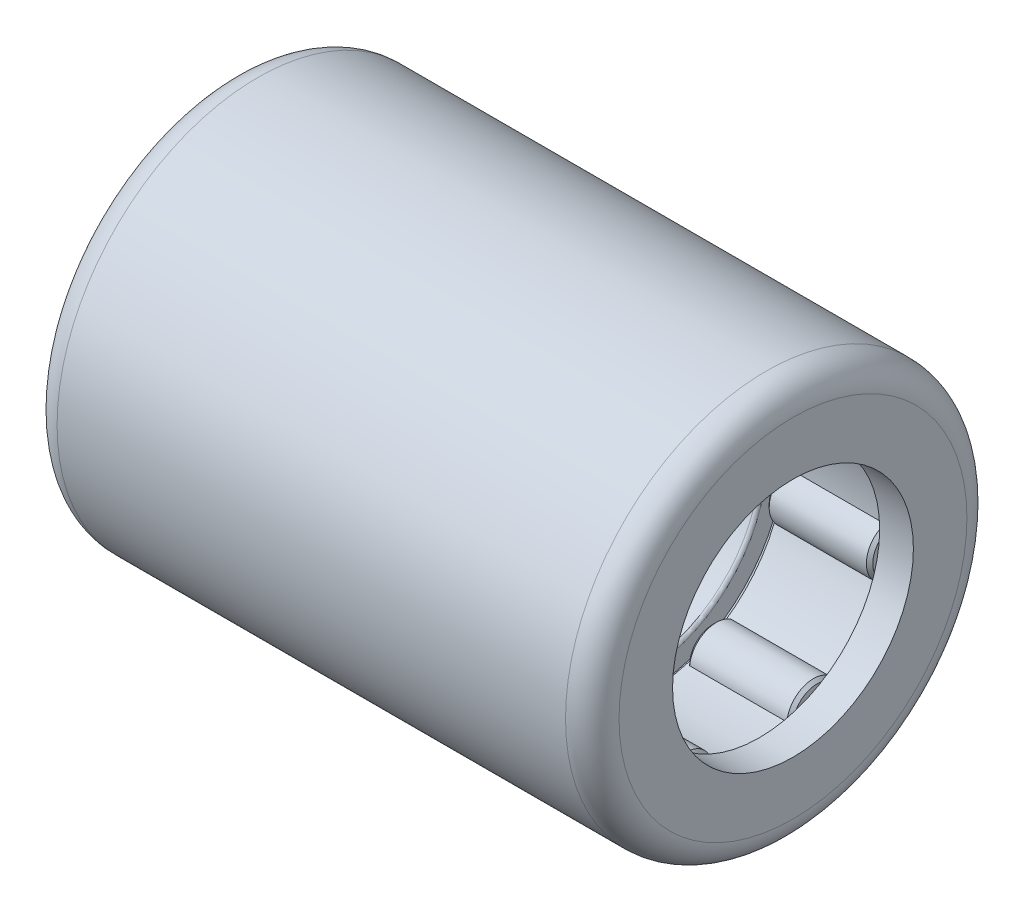
from build123d import *

# Parameters (mm, degrees)
CIRPATTERN1_COUNT = 7
CIRPATTERN2_COUNT = 11


with BuildPart() as part:
    # Sketch1 → Revolve1 (revolve)
    with BuildSketch(Plane.XY, mode=Mode.PRIVATE) as revolve1_sk:
        with BuildLine():
            Line((-11.1125, 6.879166667), (-11.1125, 4.7625))
            Line((-11.1125, 4.7625), (-9.779, 4.7625))
            Line((-9.779, 4.7625), (-9.779, 6.879166667))
            Line((-9.779, 6.879166667), (-5.174384091, 6.879166667))
            Line((-5.174384091, 6.879166667), (-4.040909091, 7.3025))
            Line((-4.040909091, 7.3025), (4.040909091, 7.3025))
            Line((4.040909091, 7.3025), (5.174384091, 6.879166667))
            Line((5.174384091, 6.879166667), (9.779, 6.879166667))
            Line((9.779, 6.879166667), (9.779, 4.7625))
            Line((9.779, 4.7625), (11.1125, 4.7625))
            Line((11.1125, 4.7625), (11.1125, 6.879166667))
            ThreePointArc((11.1125, 6.879166667), (10.802521343, 7.627521343), (10.054166667, 7.9375))
            Line((10.054166667, 7.9375), (-10.054166667, 7.9375))
            ThreePointArc((-10.054166667, 7.9375), (-10.802521343, 7.627521343), (-11.1125, 6.879166667))
        make_face()
    revolve(revolve1_sk.sketch.rotate(Axis((-11.1125, 0, 0), (1, 0, 0)), 90), axis=Axis((-11.1125, 0, 0), (1, 0, 0)))


with BuildPart() as body_2:
    # Sketch2 → Revolve2 (revolve)
    with BuildSketch(Plane.XY, mode=Mode.PRIVATE) as revolve2_sk:
        Polygon((-9.525, 5.820833333), (-5.428384091, 5.820833333), (-5.428384091, 4.8895), (-5.555384091, 4.7625), (-9.398, 4.7625), (-9.525, 4.8895), align=None)
    revolve(revolve2_sk.sketch.rotate(Axis((-9.779, 5.820833333, 0), (1, 0, 0)), 270), axis=Axis((-9.779, 5.820833333, 0), (1, 0, 0)))


with BuildPart() as body_3:
    # Mirror2: mirrored copy
    add(body_2.part.mirror(Plane(origin=(0, 0, 0), x_dir=(0, 0, 1), z_dir=(1, 0, 0))))


with BuildPart() as cirpattern1_1:
    # CirPattern1: pattern copy
    add(body_3.part.rotate(Axis((0, 0, 0), (1, 0, 0)), 1 * 360 / CIRPATTERN1_COUNT))


with BuildPart() as cirpattern1_2:
    # CirPattern1: pattern copy
    add(body_3.part.rotate(Axis((0, 0, 0), (1, 0, 0)), 2 * 360 / CIRPATTERN1_COUNT))


with BuildPart() as cirpattern1_3:
    # CirPattern1: pattern copy
    add(body_3.part.rotate(Axis((0, 0, 0), (1, 0, 0)), 3 * 360 / CIRPATTERN1_COUNT))


with BuildPart() as cirpattern1_4:
    # CirPattern1: pattern copy
    add(body_3.part.rotate(Axis((0, 0, 0), (1, 0, 0)), 4 * 360 / CIRPATTERN1_COUNT))


with BuildPart() as cirpattern1_5:
    # CirPattern1: pattern copy
    add(body_3.part.rotate(Axis((0, 0, 0), (1, 0, 0)), 5 * 360 / CIRPATTERN1_COUNT))


with BuildPart() as cirpattern1_6:
    # CirPattern1: pattern copy
    add(body_3.part.rotate(Axis((0, 0, 0), (1, 0, 0)), 6 * 360 / CIRPATTERN1_COUNT))


with BuildPart() as cirpattern1_7:
    # CirPattern1: pattern copy
    add(body_2.part.rotate(Axis((0, 0, 0), (1, 0, 0)), 1 * 360 / CIRPATTERN1_COUNT))


with BuildPart() as cirpattern1_8:
    # CirPattern1: pattern copy
    add(body_2.part.rotate(Axis((0, 0, 0), (1, 0, 0)), 2 * 360 / CIRPATTERN1_COUNT))


with BuildPart() as cirpattern1_9:
    # CirPattern1: pattern copy
    add(body_2.part.rotate(Axis((0, 0, 0), (1, 0, 0)), 3 * 360 / CIRPATTERN1_COUNT))


with BuildPart() as cirpattern1_10:
    # CirPattern1: pattern copy
    add(body_2.part.rotate(Axis((0, 0, 0), (1, 0, 0)), 4 * 360 / CIRPATTERN1_COUNT))


with BuildPart() as cirpattern1_11:
    # CirPattern1: pattern copy
    add(body_2.part.rotate(Axis((0, 0, 0), (1, 0, 0)), 5 * 360 / CIRPATTERN1_COUNT))


with BuildPart() as cirpattern1_12:
    # CirPattern1: pattern copy
    add(body_2.part.rotate(Axis((0, 0, 0), (1, 0, 0)), 6 * 360 / CIRPATTERN1_COUNT))


with BuildPart() as body_16:
    # Sketch3 → Revolve3 (revolve)
    with BuildSketch(Plane.XY, mode=Mode.PRIVATE) as revolve3_sk:
        Polygon((-3.532909091, 5.439833333), (-3.532909091, 4.6355), (-3.278909091, 4.3815), (3.278909091, 4.3815), (3.532909091, 4.6355), (3.532909091, 5.439833333), align=None)
    revolve(revolve3_sk.sketch.rotate(Axis((-3.532909091, 5.439833333, 0), (1, 0, 0)), 270), axis=Axis((-3.532909091, 5.439833333, 0), (1, 0, 0)))


with BuildPart() as cirpattern2_1:
    # CirPattern2: pattern copy
    add(body_16.part.rotate(Axis((0, 0, 0), (1, 0, 0)), 1 * 360 / CIRPATTERN2_COUNT))


with BuildPart() as cirpattern2_2:
    # CirPattern2: pattern copy
    add(body_16.part.rotate(Axis((0, 0, 0), (1, 0, 0)), 2 * 360 / CIRPATTERN2_COUNT))


with BuildPart() as cirpattern2_3:
    # CirPattern2: pattern copy
    add(body_16.part.rotate(Axis((0, 0, 0), (1, 0, 0)), 3 * 360 / CIRPATTERN2_COUNT))


with BuildPart() as cirpattern2_4:
    # CirPattern2: pattern copy
    add(body_16.part.rotate(Axis((0, 0, 0), (1, 0, 0)), 4 * 360 / CIRPATTERN2_COUNT))


with BuildPart() as cirpattern2_5:
    # CirPattern2: pattern copy
    add(body_16.part.rotate(Axis((0, 0, 0), (1, 0, 0)), 5 * 360 / CIRPATTERN2_COUNT))


with BuildPart() as cirpattern2_6:
    # CirPattern2: pattern copy
    add(body_16.part.rotate(Axis((0, 0, 0), (1, 0, 0)), 6 * 360 / CIRPATTERN2_COUNT))


with BuildPart() as cirpattern2_7:
    # CirPattern2: pattern copy
    add(body_16.part.rotate(Axis((0, 0, 0), (1, 0, 0)), 7 * 360 / CIRPATTERN2_COUNT))


with BuildPart() as cirpattern2_8:
    # CirPattern2: pattern copy
    add(body_16.part.rotate(Axis((0, 0, 0), (1, 0, 0)), 8 * 360 / CIRPATTERN2_COUNT))


with BuildPart() as cirpattern2_9:
    # CirPattern2: pattern copy
    add(body_16.part.rotate(Axis((0, 0, 0), (1, 0, 0)), 9 * 360 / CIRPATTERN2_COUNT))


with BuildPart() as cirpattern2_10:
    # CirPattern2: pattern copy
    add(body_16.part.rotate(Axis((0, 0, 0), (1, 0, 0)), 10 * 360 / CIRPATTERN2_COUNT))


with BuildPart() as body_27:
    # Sketch5 → Revolve4 (revolve)
    with BuildSketch(Plane.XY, mode=Mode.PRIVATE) as revolve4_sk:
        with BuildLine():
            Line((-5.047384091, 4.7625), (-4.167909091, 4.7625))
            ThreePointArc((-4.167909091, 4.7625), (-4.07810653, 4.799697439), (-4.040909091, 4.8895))
            Line((-4.040909091, 4.8895), (-4.040909091, 5.037666667))
            Line((-4.040909091, 5.037666667), (4.040909091, 5.037666667))
            Line((4.040909091, 5.037666667), (4.040909091, 4.8895))
            ThreePointArc((4.040909091, 4.8895), (4.07810653, 4.799697439), (4.167909091, 4.7625))
            Line((4.167909091, 4.7625), (5.047384091, 4.7625))
            ThreePointArc((5.047384091, 4.7625), (5.137186652, 4.799697439), (5.174384091, 4.8895))
            Line((5.174384091, 4.8895), (5.174384091, 5.609166667))
            Line((5.174384091, 5.609166667), (5.428384091, 5.355166667))
            Line((5.428384091, 5.355166667), (9.525, 5.355166667))
            Line((9.525, 5.355166667), (9.779, 5.609166667))
            Line((9.779, 5.609166667), (9.779, 6.879166667))
            Line((9.779, 6.879166667), (5.174384091, 6.879166667))
            Line((5.174384091, 6.879166667), (4.040909091, 7.3025))
            Line((4.040909091, 7.3025), (-4.040909091, 7.3025))
            Line((-4.040909091, 7.3025), (-5.174384091, 6.879166667))
            Line((-5.174384091, 6.879166667), (-9.779, 6.879166667))
            Line((-9.779, 6.879166667), (-9.779, 5.609166667))
            Line((-9.779, 5.609166667), (-9.525, 5.355166667))
            Line((-9.525, 5.355166667), (-5.428384091, 5.355166667))
            Line((-5.428384091, 5.355166667), (-5.174384091, 5.609166667))
            Line((-5.174384091, 5.609166667), (-5.174384091, 4.8895))
            ThreePointArc((-5.174384091, 4.8895), (-5.137186652, 4.799697439), (-5.047384091, 4.7625))
        make_face()
    revolve(revolve4_sk.sketch.rotate(Axis((9.525, 0, 0), (1, 0, 0)), 270), axis=Axis((9.525, 0, 0), (1, 0, 0)))


solid = Compound([part.part, body_2.part, body_3.part, cirpattern1_1.part, cirpattern1_2.part, cirpattern1_3.part, cirpattern1_4.part, cirpattern1_5.part, cirpattern1_6.part, cirpattern1_7.part, cirpattern1_8.part, cirpattern1_9.part, cirpattern1_10.part, cirpattern1_11.part, cirpattern1_12.part, body_16.part, cirpattern2_1.part, cirpattern2_2.part, cirpattern2_3.part, cirpattern2_4.part, cirpattern2_5.part, cirpattern2_6.part, cirpattern2_7.part, cirpattern2_8.part, cirpattern2_9.part, cirpattern2_10.part, body_27.part])
